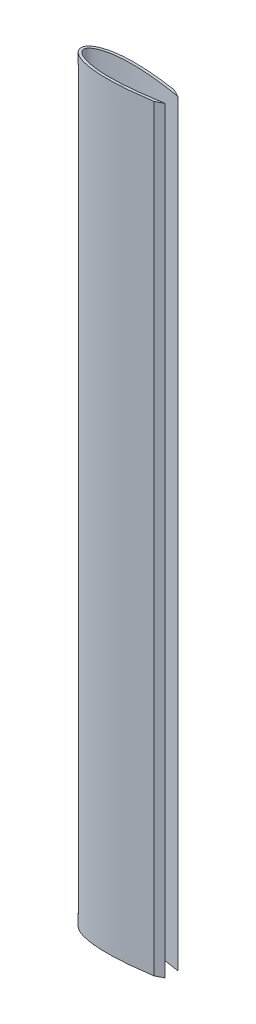
from build123d import *

# Parameters (mm, degrees)
BOSS_EXTRUDE1_DEPTH = 1000


with BuildPart() as part:
    # Sketch2 → Boss-Extrude1 (new body)
    with BuildSketch(Plane(origin=(0, 0, 0), x_dir=(1, 0, 0), z_dir=(0, 1, 0))):
        with BuildLine():
            add(Edge.make_bspline(
                [(109.462602503, -13.321838119), (107.975880039, -13.546641862), (100.670653538, -14.624625392), (87.535716143, -16.313216812), (70.03125665, -17.920489831), (55.419740469, -18.498206693), (43.740710812, -18.258850491), (34.970852929, -17.662825812), (26.180275143, -16.488742945), (18.866823, -14.856026844), (13.046149978, -12.902730876), (8.567704941, -10.940591425), (4.837646352, -8.559997012), (1.351459331, -5.192172891), (-0.89986404, 0), (1.351459331, 5.192172891), (4.837646352, 8.559997012), (8.567704941, 10.940591425), (13.046149978, 12.902730876), (18.866823, 14.856026844), (26.180275143, 16.488742945), (34.970852929, 17.662825812), (43.740710812, 18.258850491), (55.419740469, 18.498206693), (70.03125665, 17.920489831), (87.535716143, 16.313216812), (100.670653538, 14.624625392), (107.975880039, 13.546641862), (109.462602503, 13.321838119)],
                knots=[0.182219909, 0.182219909, 0.182219909, 0.182219909, 0.194520662, 0.242628784, 0.290540245, 0.338291453, 0.362158191, 0.386079128, 0.410163587, 0.434658434, 0.447240239, 0.460336948, 0.474609083, 0.483093555, 0.5, 0.516906445, 0.525390917, 0.539663052, 0.552759761, 0.565341566, 0.589836413, 0.613920872, 0.637841809, 0.661708547, 0.709459755, 0.757371216, 0.805479338, 0.817780091, 0.817780091, 0.817780091, 0.817780091], degree=3))
            Line((109.462602503, -13.321838119), (119.460181569, -8.31141336))
            add(Edge.make_bspline(
                [(119.460181569, -8.31141336), (117.001148958, -8.722449413), (108.938887236, -10.027463313), (95.252805448, -11.984095551), (78.369781378, -13.850715055), (61.469614635, -15.012474615), (49.010213131, -15.07933207), (41.513732255, -14.705305727), (39.609262198, -14.576373717), (38.914332089, -14.524429278)],
                knots=[0.153079117, 0.153079117, 0.153079117, 0.153079117, 0.173566209, 0.220199608, 0.266833006, 0.313466405, 0.360099804, 0.370224419, 0.376053594, 0.376053594, 0.376053594, 0.376053594], degree=3))
            add(Edge.make_bspline(
                [(38.914332089, -14.524429278), (38.219401979, -14.47248484), (36.831387049, -14.358925102), (33.189148087, -14.005492616), (27.514869075, -13.256584441), (21.280024209, -11.971608567), (16.109637192, -10.404366011), (12.368777685, -8.969984138), (9.496307204, -7.511671979), (7.433855515, -6.147783963), (6.014579915, -5.007346065), (4.901073331, -3.863918966), (4.044450473, -2.579690635), (3.58134529, -1.43849945), (3.403488034, -0.583515702), (3.360755983, 0), (3.403488034, 0.583515702), (3.58134529, 1.43849945), (4.044450473, 2.579690635), (4.901073331, 3.863918966), (6.014579915, 5.007346065), (7.433855515, 6.147783963), (9.496307204, 7.511671979), (12.368777685, 8.969984138), (16.109637192, 10.404366011), (21.280024209, 11.971608567), (27.514869075, 13.256584441), (33.189148087, 14.005492616), (36.831387049, 14.358925102), (38.219401979, 14.47248484), (38.914332089, 14.524429278)],
                knots=[0.376053594, 0.376053594, 0.376053594, 0.376053594, 0.381882769, 0.387711944, 0.406733203, 0.430049902, 0.441708252, 0.453366601, 0.465024951, 0.470854126, 0.476683301, 0.482512475, 0.48834165, 0.494170825, 0.497085413, 0.5, 0.502914587, 0.505829175, 0.51165835, 0.517487525, 0.523316699, 0.529145874, 0.534975049, 0.546633399, 0.558291748, 0.569950098, 0.593266797, 0.612288056, 0.618117231, 0.623946406, 0.623946406, 0.623946406, 0.623946406], degree=3))
            add(Edge.make_bspline(
                [(38.914332089, 14.524429278), (39.609262198, 14.576373717), (41.513732255, 14.705305727), (49.010213131, 15.07933207), (61.469614635, 15.012474615), (78.369781378, 13.850715055), (95.252805448, 11.984095551), (108.15390863, 10.139687869), (116.217830375, 8.848624143), (118.67835944, 8.441317021), (119.462602503, 8.310200076)],
                knots=[0.623946406, 0.623946406, 0.623946406, 0.623946406, 0.629775581, 0.639900196, 0.686533595, 0.733166994, 0.779800392, 0.826433791, 0.840396417, 0.846930572, 0.846930572, 0.846930572, 0.846930572], degree=3))
            Line((119.462602503, 8.310200076), (109.462602503, 13.321838119))
        make_face()
    extrude(amount=BOSS_EXTRUDE1_DEPTH)


solid = part.part
